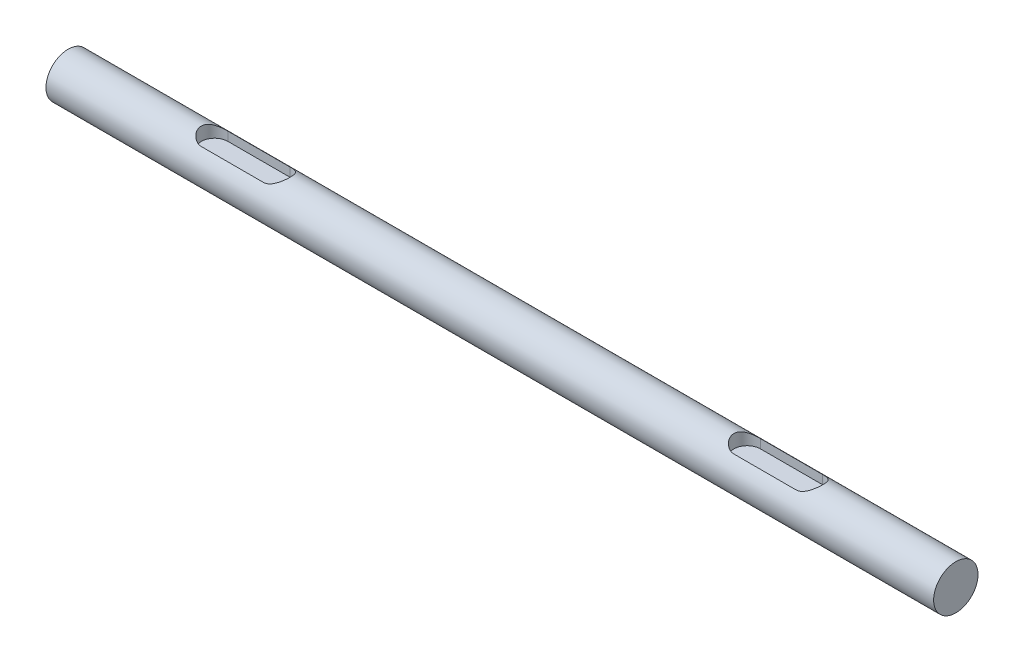
from build123d import *

# Parameters (mm, degrees)
SKETCH_1_R          = 5
EXTRUDE_1_DEPTH     = 100
CUT_EXTRUDE_1_DEPTH = 3
SKETCH_3_R          = 5
EXTRUDE_2_DEPTH     = 100
CUT_EXTRUDE_2_DEPTH = 3


with BuildPart() as part:
    # 草图1 → 凸台-拉伸1 (new body)
    with BuildSketch(Plane(origin=(0, 0, 0), x_dir=(0, 0, -1), z_dir=(1, 0, 0))):
        Circle(SKETCH_1_R)
    extrude(amount=EXTRUDE_1_DEPTH)

    # 草图2 → 切除-拉伸1 (cut)
    with BuildSketch(Plane(origin=(0, 5, 0), x_dir=(1, 0, 0), z_dir=(0, 1, 0))):
        with BuildLine():
            Line((33, 3), (47, 3))
            ThreePointArc((47, 3), (50, 0), (47, -3))
            Line((47, -3), (33, -3))
            ThreePointArc((33, -3), (30, 0), (33, 3))
        make_face()
    extrude(amount=-CUT_EXTRUDE_1_DEPTH, mode=Mode.SUBTRACT)

    # 草图3 → 凸台-拉伸2 (add)
    with BuildSketch(Plane(origin=(100, 0, 0), x_dir=(0, 0, -1), z_dir=(1, 0, 0))):
        Circle(SKETCH_3_R)
    extrude(amount=EXTRUDE_2_DEPTH)

    # 草图4 → 切除-拉伸2 (cut)
    with BuildSketch(Plane(origin=(0, 5, 0), x_dir=(1, 0, 0), z_dir=(0, 1, 0))):
        with BuildLine():
            Line((153, 3), (167, 3))
            ThreePointArc((167, 3), (170, 0), (167, -3))
            Line((167, -3), (153, -3))
            ThreePointArc((153, -3), (150, 0), (153, 3))
        make_face()
    extrude(amount=-CUT_EXTRUDE_2_DEPTH, mode=Mode.SUBTRACT)


solid = part.part
